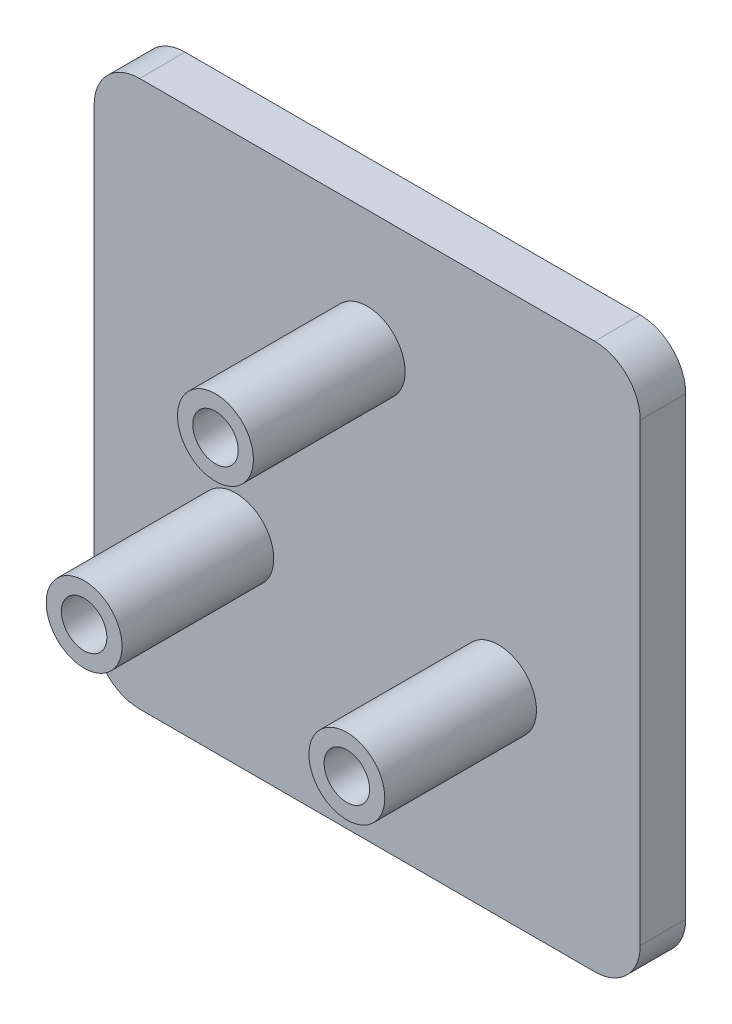
from build123d import *

# Parameters (mm, degrees)
SKETCH1_R           = 2.5
SKETCH1_R_2         = 1.5
BOSS_EXTRUDE1_DEPTH = 3
BOSS_EXTRUDE2_START = 3
SKETCH1_3_R         = 2.5
SKETCH1_3_R_2       = 1.5
BOSS_EXTRUDE2_DEPTH = 10


with BuildPart() as part:
    # Sketch1 → Boss-Extrude1 (new body)
    # profile 1 of 7: a face of its own
    with BuildSketch(Plane.XY):
        with BuildLine():
            ThreePointArc((-18, 15), (-17.121320344, 17.121320344), (-15, 18))
            Line((-15, 18), (15, 18))
            ThreePointArc((15, 18), (17.121320344, 17.121320344), (18, 15))
            Line((18, 15), (18, -15))
            ThreePointArc((18, -15), (17.121320344, -17.121320344), (15, -18))
            Line((15, -18), (-15, -18))
            ThreePointArc((-15, -18), (-17.121320344, -17.121320344), (-18, -15))
            Line((-18, -15), (-18, 15))
        make_face()
        with Locations((-8.660254038, -5)):
            Circle(SKETCH1_R, mode=Mode.SUBTRACT)
        with Locations((8.660254038, -5)):
            Circle(SKETCH1_R, mode=Mode.SUBTRACT)
        with Locations((0, 10)):
            Circle(SKETCH1_R, mode=Mode.SUBTRACT)
    # profile 2 of 7: a face of its own
    with BuildSketch(Plane.XY):
        with Locations((-8.660254038, -5)):
            Circle(SKETCH1_R)
        with Locations((-8.660254038, -5)):
            Circle(SKETCH1_R_2, mode=Mode.SUBTRACT)
    # profile 3 of 7: a face of its own
    with BuildSketch(Plane.XY):
        with Locations((-8.660254038, -5)):
            Circle(SKETCH1_R_2)
    # profile 4 of 7: a face of its own
    with BuildSketch(Plane.XY):
        with Locations((0, 10)):
            Circle(SKETCH1_R)
        with Locations((0, 10)):
            Circle(SKETCH1_R_2, mode=Mode.SUBTRACT)
    # profile 5 of 7: a face of its own
    with BuildSketch(Plane.XY):
        with Locations((0, 10)):
            Circle(SKETCH1_R_2)
    # profile 6 of 7: a face of its own
    with BuildSketch(Plane.XY):
        with Locations((8.660254038, -5)):
            Circle(SKETCH1_R)
        with Locations((8.660254038, -5)):
            Circle(SKETCH1_R_2, mode=Mode.SUBTRACT)
    # profile 7 of 7: a face of its own
    with BuildSketch(Plane.XY):
        with Locations((8.660254038, -5)):
            Circle(SKETCH1_R_2)
    extrude(amount=BOSS_EXTRUDE1_DEPTH)

    # Sketch1<3> → Boss-Extrude2 (add)
    # profile 1 of 3: a face of its own
    with BuildSketch(Plane.XY.offset(BOSS_EXTRUDE2_START)):
        with Locations((-8.660254038, -5)):
            Circle(SKETCH1_3_R)
        with Locations((-8.660254038, -5)):
            Circle(SKETCH1_3_R_2, mode=Mode.SUBTRACT)
    # profile 2 of 3: a face of its own
    with BuildSketch(Plane.XY.offset(BOSS_EXTRUDE2_START)):
        with Locations((0, 10)):
            Circle(SKETCH1_3_R)
        with Locations((0, 10)):
            Circle(SKETCH1_3_R_2, mode=Mode.SUBTRACT)
    # profile 3 of 3: a face of its own
    with BuildSketch(Plane.XY.offset(BOSS_EXTRUDE2_START)):
        with Locations((8.660254038, -5)):
            Circle(SKETCH1_3_R)
        with Locations((8.660254038, -5)):
            Circle(SKETCH1_3_R_2, mode=Mode.SUBTRACT)
    extrude(amount=BOSS_EXTRUDE2_DEPTH)


solid = part.part
